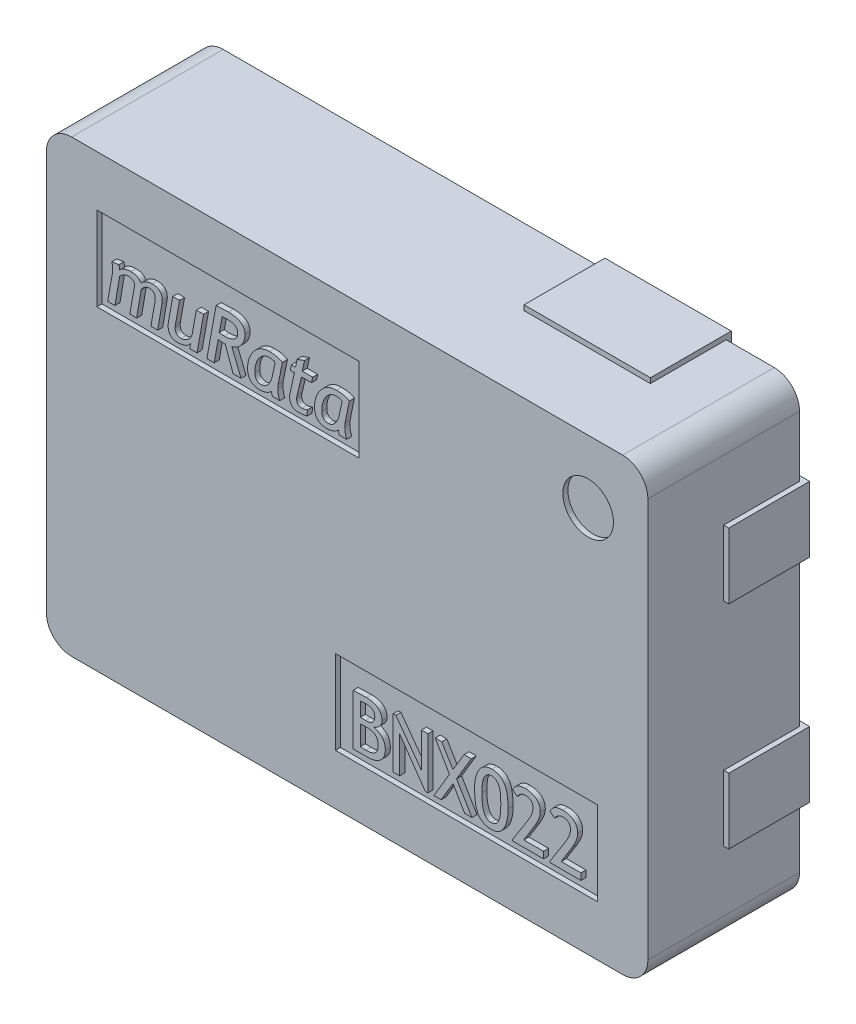
from build123d import *

# Parameters (mm, degrees)
SKETCH_1_W          = 1
SKETCH_1_H          = 1.3
EXTRUDE_1_DEPTH     = 1.6
EXTRUDE_1_2_DEPTH   = 1.6
EXTRUDE_1_3_DEPTH   = 1.6
EXTRUDE_1_4_DEPTH   = 1.6
SKETCH_1_W_2        = 7
SKETCH_1_H_2        = 0.3
EXTRUDE_1_5_DEPTH   = 1.6
SKETCH_1_W_3        = 2.5
EXTRUDE_1_6_DEPTH   = 1.6
SKETCH_2_W          = 11.9
SKETCH_2_H          = 8.9
EXTRUDE_2_DEPTH     = 3
SKETCH_3_R          = 0.5
SKETCH_3_W          = 5.181994718
SKETCH_3_H          = 1.659340636
CUT_EXTRUDE_1_DEPTH = 0.1
EXTRUDE_3_DEPTH     = 0.1
FILLET_1_R          = 0.5


with BuildPart() as part:
    # Эскиз1 → Бобышка-Вытянуть1 (new body)
    with BuildSketch(Plane.XY):
        with Locations((-5.55, -2.1)):
            Rectangle(SKETCH_1_W, SKETCH_1_H)
    extrude(amount=EXTRUDE_1_DEPTH)



with BuildPart() as body_2:
    # Эскиз1 → Extrude 1 2 (new body)
    with BuildSketch(Plane.XY):
        with Locations((-5.55, 2.1)):
            Rectangle(SKETCH_1_W, SKETCH_1_H)
    extrude(amount=EXTRUDE_1_2_DEPTH)


with BuildPart() as body_3:
    # Эскиз1 → Extrude 1 3 (new body)
    with BuildSketch(Plane.XY):
        with Locations((5.55, -2.1)):
            Rectangle(SKETCH_1_W, SKETCH_1_H)
    extrude(amount=EXTRUDE_1_3_DEPTH)


with BuildPart() as body_4:
    # Эскиз1 → Extrude 1 4 (new body)
    with BuildSketch(Plane.XY):
        with Locations((5.55, 2.1)):
            Rectangle(SKETCH_1_W, SKETCH_1_H)
    extrude(amount=EXTRUDE_1_4_DEPTH)


with BuildPart() as body_5:
    # Эскиз1 → Extrude 1 5 (new body)
    with BuildSketch(Plane.XY):
        with Locations((1, -4.4)):
            Rectangle(SKETCH_1_W_2, SKETCH_1_H_2)
    extrude(amount=EXTRUDE_1_5_DEPTH)


with BuildPart() as body_6:
    # Эскиз1 → Extrude 1 6 (new body)
    with BuildSketch(Plane.XY):
        with Locations((3.25, 4.4)):
            Rectangle(SKETCH_1_W_3, SKETCH_1_H_2)
    extrude(amount=EXTRUDE_1_6_DEPTH)


with BuildPart() as part_1:
    add(part.part)

    add(body_2.part)  # Бобышка-Вытянуть2 merges body 2

    add(body_3.part)  # Бобышка-Вытянуть2 merges body 3

    add(body_4.part)  # Бобышка-Вытянуть2 merges body 4

    add(body_5.part)  # Бобышка-Вытянуть2 merges body 5

    add(body_6.part)  # Бобышка-Вытянуть2 merges body 6
    # Эскиз2 → Бобышка-Вытянуть2 (add)
    with BuildSketch(Plane.XY.offset(0.1)):
        Rectangle(SKETCH_2_W, SKETCH_2_H)
    extrude(amount=EXTRUDE_2_DEPTH)

    # Эскиз3 → Вырез-Вытянуть1 (cut)
    with BuildSketch(Plane.XY.offset(3.1)):
        with Locations((4.768230873, 3.203976716)):
            Circle(SKETCH_3_R)
        with Locations((-2.359002641, 2.620329682)):
            Rectangle(SKETCH_3_W, SKETCH_3_H)
        with Locations((2.359002641, -2.620329682)):
            Rectangle(SKETCH_3_W, SKETCH_3_H)
    extrude(amount=-CUT_EXTRUDE_1_DEPTH, mode=Mode.SUBTRACT)

    # Эскиз4 → Бобышка-Вытянуть3 (add)
    # profile 1 of 12: a face of its own
    with BuildSketch(Plane.XY.offset(3)):
        with BuildLine():
            Line((-3.881526992, 1.990659364), (-3.801981537, 2.454336312))
            add(Edge.make_bspline(
                [(-3.801981537, 2.454336312), (-3.800646377, 2.463316333), (-3.798045168, 2.480811548), (-3.797553589, 2.498491126), (-3.797314329, 2.507096052)],
                knots=[0, 0, 0, 0, 1.02656884, 2, 2, 2, 2], degree=3))
            add(Edge.make_bspline(
                [(-3.797314329, 2.507096052), (-3.797596482, 2.516531636), (-3.798128241, 2.534314377), (-3.803836438, 2.559106752), (-3.813195308, 2.580216933), (-3.826515071, 2.597667715), (-3.843856784, 2.611160489), (-3.865034541, 2.62049005), (-3.88975161, 2.626197259), (-3.907467207, 2.626737378), (-3.916835433, 2.627023)],
                knots=[0, 0, 0, 0, 1.165338575, 2.196251465, 3.124750257, 4.001607519, 4.883598347, 5.812097139, 6.843010029, 8, 8, 8, 8], degree=3))
            add(Edge.make_bspline(
                [(-3.916835433, 2.627023), (-3.92417594, 2.626673684), (-3.93913903, 2.62596163), (-3.961525805, 2.619878562), (-3.983929085, 2.610214975), (-4.005947727, 2.597084937), (-4.026611718, 2.581388067), (-4.045141497, 2.563769163), (-4.061021095, 2.544497129), (-4.06921666, 2.53022001), (-4.073288355, 2.523126896)],
                knots=[0, 0, 0, 0, 0.897125573, 1.828725236, 2.818944493, 3.876622128, 4.957752456, 5.988225249, 7.000516339, 8, 8, 8, 8], degree=3))
            Line((-4.073288355, 2.523126896), (-4.164197446, 1.990659364))
            Line((-4.164197446, 1.990659364), (-4.298734784, 1.990659364))
            Line((-4.298734784, 1.990659364), (-4.208637381, 2.510342805))
            add(Edge.make_bspline(
                [(-4.208637381, 2.510342805), (-4.207993245, 2.514053475), (-4.206780744, 2.521038313), (-4.206663241, 2.528124858), (-4.20660816, 2.531446701)],
                knots=[0, 0, 0, 0, 1.062492834, 2, 2, 2, 2], degree=3))
            add(Edge.make_bspline(
                [(-4.20660816, 2.531446701), (-4.206935277, 2.53893856), (-4.207561159, 2.553272992), (-4.21404408, 2.573279926), (-4.224635661, 2.59032131), (-4.239699736, 2.604095808), (-4.258831583, 2.614652572), (-4.281984582, 2.621998915), (-4.309119839, 2.626404006), (-4.328545819, 2.626807603), (-4.338913355, 2.627023)],
                knots=[0, 0, 0, 0, 0.966132594, 1.848535045, 2.685778888, 3.533692158, 4.458059346, 5.489792084, 6.660316188, 8, 8, 8, 8], degree=3))
            add(Edge.make_bspline(
                [(-4.338913355, 2.627023), (-4.345775226, 2.626631649), (-4.360022871, 2.625819067), (-4.381861842, 2.620106898), (-4.404745653, 2.61107934), (-4.428066055, 2.598921255), (-4.45035987, 2.584639993), (-4.470610127, 2.569499953), (-4.487902564, 2.553534703), (-4.497322323, 2.541777371), (-4.501859784, 2.536113909)],
                knots=[0, 0, 0, 0, 0.858131112, 1.781780593, 2.80801687, 3.932170532, 5.066093008, 6.117186899, 7.093056259, 8, 8, 8, 8], degree=3))
            Line((-4.501859784, 2.536113909), (-4.592768875, 1.990659364))
            Line((-4.592768875, 1.990659364), (-4.737452316, 1.990659364))
            Line((-4.737452316, 1.990659364), (-4.641673095, 2.524344429))
            add(Edge.make_bspline(
                [(-4.641673095, 2.524344429), (-4.641006323, 2.528599074), (-4.639561684, 2.537817247), (-4.638551057, 2.552809944), (-4.637636748, 2.569990497), (-4.637622336, 2.582175389), (-4.637614654, 2.588670727)],
                knots=[0, 0, 0, 0, 0.800541423, 1.734464059, 2.792322178, 4, 4, 4, 4], degree=3))
            add(Edge.make_bspline(
                [(-4.637614654, 2.588670727), (-4.63780645, 2.600251216), (-4.638173289, 2.622400704), (-4.642056821, 2.653853401), (-4.648183557, 2.682057251), (-4.655042864, 2.698930701), (-4.658312706, 2.706974299)],
                knots=[0, 0, 0, 0, 1.148139457, 2.195995544, 3.140028527, 4, 4, 4, 4], degree=3))
            Line((-4.658312706, 2.706974299), (-4.516267251, 2.730919104))
            add(Edge.make_bspline(
                [(-4.516267251, 2.730919104), (-4.514367389, 2.722817467), (-4.51066186, 2.707015872), (-4.506481421, 2.683713319), (-4.50322666, 2.661528383), (-4.50230723, 2.647054042), (-4.501859784, 2.640010013)],
                knots=[0, 0, 0, 0, 1.08313698, 2.112572101, 3.081471322, 4, 4, 4, 4], degree=3))
            add(Edge.make_bspline(
                [(-4.501859784, 2.640010013), (-4.496752928, 2.646853142), (-4.486268566, 2.660902068), (-4.465222185, 2.678607834), (-4.440154438, 2.694239438), (-4.4110326, 2.706999748), (-4.379664394, 2.71762189), (-4.346991924, 2.72535121), (-4.313608602, 2.729900486), (-4.29117274, 2.730577718), (-4.279863031, 2.730919104)],
                knots=[0, 0, 0, 0, 0.822505251, 1.688601343, 2.636803891, 3.669145775, 4.751892822, 5.832804686, 6.907536918, 8, 8, 8, 8], degree=3))
            add(Edge.make_bspline(
                [(-4.279863031, 2.730919104), (-4.267400282, 2.730635822), (-4.243520809, 2.730093033), (-4.209403781, 2.72522229), (-4.178639817, 2.717160339), (-4.151214649, 2.705970432), (-4.127388141, 2.691069161), (-4.107035758, 2.673021394), (-4.089960174, 2.651647343), (-4.081862319, 2.635312809), (-4.077752641, 2.627023)],
                knots=[0, 0, 0, 0, 1.237715316, 2.371546605, 3.414827764, 4.39083205, 5.30264959, 6.192812572, 7.082848704, 8, 8, 8, 8], degree=3))
            add(Edge.make_bspline(
                [(-4.077752641, 2.627023), (-4.072216638, 2.634379287), (-4.060856313, 2.64947498), (-4.039038253, 2.669250895), (-4.013047192, 2.686821497), (-3.983580627, 2.702146321), (-3.952109685, 2.714596144), (-3.920116822, 2.724159525), (-3.888153704, 2.729806888), (-3.866869804, 2.730551556), (-3.856364654, 2.730919104)],
                knots=[0, 0, 0, 0, 0.871689691, 1.788777654, 2.776398268, 3.841032672, 4.932299696, 5.981885438, 7.003913911, 8, 8, 8, 8], degree=3))
            add(Edge.make_bspline(
                [(-3.856364654, 2.730919104), (-3.848312311, 2.730735849), (-3.832790151, 2.730382596), (-3.810180508, 2.728446064), (-3.789249923, 2.72474404), (-3.769688641, 2.719995395), (-3.751783852, 2.713415225), (-3.735300325, 2.705631131), (-3.720501697, 2.69613864), (-3.707230726, 2.685314059), (-3.695344491, 2.67317994), (-3.685366379, 2.65933327), (-3.67681314, 2.644220738), (-3.669623583, 2.627657391), (-3.664251639, 2.609589091), (-3.660366428, 2.590096815), (-3.658202838, 2.56923923), (-3.657873075, 2.554855167), (-3.65770394, 2.547477546)],
                knots=[0, 0, 0, 0, 1.246591708, 2.403002083, 3.508033586, 4.533898789, 5.514251456, 6.455472193, 7.349999276, 8.228077579, 9.101775788, 9.970819607, 10.861662966, 11.785487015, 12.759220529, 13.77353434, 14.858040255, 16, 16, 16, 16], degree=3))
            add(Edge.make_bspline(
                [(-3.65770394, 2.547477546), (-3.65793856, 2.536701113), (-3.658423152, 2.51444317), (-3.661964723, 2.492461186), (-3.663791602, 2.481122026)],
                knots=[0, 0, 0, 0, 0.968322441, 2, 2, 2, 2], degree=3))
            Line((-3.663791602, 2.481122026), (-3.748613031, 1.990659364))
            Line((-3.748613031, 1.990659364), (-3.881526992, 1.990659364))
        make_face()
    # profile 2 of 12: a face of its own
    with BuildSketch(Plane.XY.offset(3)):
        with BuildLine():
            Line((-3.31598316, 2.717932091), (-3.397557836, 2.256487286))
            add(Edge.make_bspline(
                [(-3.397557836, 2.256487286), (-3.399043145, 2.246968832), (-3.401877164, 2.228807312), (-3.402525342, 2.210439545), (-3.40283381, 2.201698325)],
                knots=[0, 0, 0, 0, 1.0482001, 2, 2, 2, 2], degree=3))
            add(Edge.make_bspline(
                [(-3.40283381, 2.201698325), (-3.402562252, 2.192258041), (-3.402050461, 2.174466442), (-3.396202175, 2.149699382), (-3.387256464, 2.128367408), (-3.373817319, 2.110928009), (-3.356539927, 2.097486276), (-3.335531491, 2.088090496), (-3.311006253, 2.082395856), (-3.293424741, 2.081854712), (-3.284124394, 2.081568455)],
                knots=[0, 0, 0, 0, 1.168243006, 2.201725291, 3.136760649, 4.015803345, 4.899992402, 5.823179172, 6.84849556, 8, 8, 8, 8], degree=3))
            add(Edge.make_bspline(
                [(-3.284124394, 2.081568455), (-3.278026554, 2.081705185), (-3.265907617, 2.081976924), (-3.247830612, 2.08477561), (-3.229948395, 2.089208039), (-3.212263666, 2.095589658), (-3.194774039, 2.103555021), (-3.177358235, 2.113084643), (-3.160405913, 2.124778681), (-3.143726055, 2.13784429), (-3.127807978, 2.151969853), (-3.113610449, 2.167293665), (-3.100945135, 2.18313878), (-3.089964267, 2.199642393), (-3.080468282, 2.21673736), (-3.073055632, 2.234690868), (-3.0670021, 2.253263503), (-3.064436781, 2.266060446), (-3.063142251, 2.27251813)],
                knots=[0, 0, 0, 0, 0.929686712, 1.847672986, 2.783752511, 3.736856134, 4.711340751, 5.713677239, 6.761263039, 7.849192658, 8.945314047, 10.004023173, 11.032267895, 12.036886102, 13.025206201, 14.010342428, 14.995964995, 16, 16, 16, 16], degree=3))
            Line((-3.063142251, 2.27251813), (-2.983393875, 2.717932091))
            Line((-2.983393875, 2.717932091), (-2.839522121, 2.717932091))
            Line((-2.839522121, 2.717932091), (-2.969392251, 1.990659364))
            Line((-2.969392251, 1.990659364), (-3.114278615, 1.990659364))
            Line((-3.114278615, 1.990659364), (-3.093783485, 2.094555468))
            add(Edge.make_bspline(
                [(-3.093783485, 2.094555468), (-3.100465242, 2.085184532), (-3.113770103, 2.066524919), (-3.138814966, 2.042809302), (-3.16690558, 2.022372522), (-3.19874986, 2.00590362), (-3.234051221, 1.993204406), (-3.272787435, 1.984127303), (-3.314945695, 1.97862684), (-3.3442396, 1.977997984), (-3.359408485, 1.977672351)],
                knots=[0, 0, 0, 0, 0.909652853, 1.811320582, 2.716799533, 3.653680856, 4.63998368, 5.680763126, 6.799059422, 8, 8, 8, 8], degree=3))
            add(Edge.make_bspline(
                [(-3.359408485, 1.977672351), (-3.366384567, 1.977809832), (-3.379908294, 1.978076351), (-3.399573343, 1.980665282), (-3.418092957, 1.98437697), (-3.435487503, 1.989936221), (-3.451749869, 1.996941931), (-3.466744959, 2.005831575), (-3.48053038, 2.016199472), (-3.493262795, 2.027980876), (-3.504356793, 2.041453364), (-3.514139978, 2.056141017), (-3.522581763, 2.072065489), (-3.529200708, 2.089479417), (-3.534515254, 2.108139196), (-3.538054735, 2.128133425), (-3.540353789, 2.149358625), (-3.540662052, 2.163948429), (-3.540820823, 2.171462935)],
                knots=[0, 0, 0, 0, 1.10943704, 2.150737634, 3.15130267, 4.111213706, 5.051062776, 5.962947454, 6.877812674, 7.791600948, 8.716290168, 9.647657733, 10.59609568, 11.577489236, 12.606479557, 13.678909857, 14.804518185, 16, 16, 16, 16], degree=3))
            add(Edge.make_bspline(
                [(-3.540820823, 2.171462935), (-3.540522787, 2.182781588), (-3.539900802, 2.206402984), (-3.536102609, 2.22972834), (-3.534124394, 2.241876896)],
                knots=[0, 0, 0, 0, 0.958339047, 2, 2, 2, 2], degree=3))
            Line((-3.534124394, 2.241876896), (-3.449911732, 2.717932091))
            Line((-3.449911732, 2.717932091), (-3.31598316, 2.717932091))
        make_face()
    # profile 3 of 12: a face of its own
    with BuildSketch(Plane.XY.offset(3)):
        with BuildLine():
            Line((-2.255106537, 1.990659364), (-2.410950693, 2.419230792))
            add(Edge.make_bspline(
                [(-2.410950693, 2.419230792), (-2.420289212, 2.419412222), (-2.440548305, 2.419805816), (-2.473300146, 2.422484303), (-2.510788985, 2.426518462), (-2.537313438, 2.430243397), (-2.551372771, 2.432217805)],
                knots=[0, 0, 0, 0, 0.794054174, 1.722630377, 2.792876285, 4, 4, 4, 4], degree=3))
            Line((-2.551372771, 2.432217805), (-2.629903615, 1.990659364))
            Line((-2.629903615, 1.990659364), (-2.774587057, 1.990659364))
            Line((-2.774587057, 1.990659364), (-2.592768875, 2.990659364))
            add(Edge.make_bspline(
                [(-2.592768875, 2.990659364), (-2.590197383, 2.990702145), (-2.584439991, 2.99079793), (-2.574984845, 2.991571501), (-2.563745845, 2.992057214), (-2.550904591, 2.992979601), (-2.536343533, 2.99363957), (-2.520197968, 2.995029477), (-2.502260832, 2.99613686), (-2.476771986, 2.998064296), (-2.44539024, 3.000149844), (-2.410024732, 3.002342782), (-2.378285717, 3.003309275), (-2.358394248, 3.003538707), (-2.349059459, 3.003646377)],
                knots=[0, 0, 0, 0, 0.379205994, 0.84901576, 1.398492177, 2.038179615, 2.747573999, 3.547867495, 4.427762936, 5.397917485, 7.317627882, 9.066214761, 10.623215523, 12, 12, 12, 12], degree=3))
            add(Edge.make_bspline(
                [(-2.349059459, 3.003646377), (-2.336336882, 3.003535537), (-2.311533993, 3.003319454), (-2.27550345, 3.000351666), (-2.241701159, 2.995931623), (-2.210104698, 2.990014354), (-2.180900609, 2.981852174), (-2.153857204, 2.972111467), (-2.129048802, 2.960641343), (-2.106626331, 2.947201682), (-2.086590441, 2.932138019), (-2.069048058, 2.91554135), (-2.05423254, 2.89726097), (-2.042143321, 2.877401747), (-2.032812594, 2.855947375), (-2.026016755, 2.833000386), (-2.022225738, 2.808493258), (-2.021639922, 2.791672933), (-2.021340303, 2.783070078)],
                knots=[0, 0, 0, 0, 1.371015623, 2.672819113, 3.893705581, 5.04478121, 6.134436109, 7.158501773, 8.140297429, 9.075592003, 9.970929856, 10.837300292, 11.671951042, 12.499726858, 13.335523232, 14.186821977, 15.072639292, 16, 16, 16, 16], degree=3))
            add(Edge.make_bspline(
                [(-2.021340303, 2.783070078), (-2.021583322, 2.772778794), (-2.022064335, 2.75240901), (-2.025618006, 2.722353767), (-2.031221001, 2.693208521), (-2.039350679, 2.665076596), (-2.050026788, 2.638080814), (-2.062623278, 2.611875974), (-2.077671036, 2.586659595), (-2.095078727, 2.562761283), (-2.113976298, 2.540279998), (-2.134401801, 2.519995372), (-2.155715992, 2.501492399), (-2.178500663, 2.485521659), (-2.202407114, 2.471623992), (-2.22742584, 2.459800514), (-2.25372663, 2.450179807), (-2.271903949, 2.445525348), (-2.281080563, 2.443175598)],
                knots=[0, 0, 0, 0, 1.068642213, 2.115189014, 3.138850416, 4.148213864, 5.151422374, 6.150564156, 7.164999814, 8.196441807, 9.218269553, 10.211764462, 11.183283622, 12.146128331, 13.096799659, 14.052131676, 15.016640767, 16, 16, 16, 16], degree=3))
            Line((-2.281080563, 2.443175598), (-2.099262381, 1.990659364))
            Line((-2.099262381, 1.990659364), (-2.255106537, 1.990659364))
        make_face()
        with BuildLine():
            Line((-2.471624394, 2.861195078), (-2.530471797, 2.562087935))
            add(Edge.make_bspline(
                [(-2.530471797, 2.562087935), (-2.522173938, 2.560087548), (-2.505873667, 2.556157997), (-2.481595086, 2.552202212), (-2.458086172, 2.549582033), (-2.442680875, 2.549259615), (-2.43509842, 2.549100922)],
                knots=[0, 0, 0, 0, 1.06117625, 2.084569028, 3.057228794, 4, 4, 4, 4], degree=3))
            add(Edge.make_bspline(
                [(-2.43509842, 2.549100922), (-2.425150312, 2.549260459), (-2.405769572, 2.549571265), (-2.377458674, 2.551878634), (-2.35058474, 2.555381776), (-2.325291112, 2.560788349), (-2.301284161, 2.567060748), (-2.279032759, 2.575593184), (-2.257964077, 2.584940955), (-2.238758382, 2.596179719), (-2.221222804, 2.608432895), (-2.20595795, 2.622045831), (-2.192936929, 2.636745567), (-2.182555725, 2.652743076), (-2.174359876, 2.669718139), (-2.168378666, 2.687770055), (-2.164910609, 2.707044405), (-2.164438907, 2.720285542), (-2.164197446, 2.727063585)],
                knots=[0, 0, 0, 0, 1.318555309, 2.568787749, 3.76331209, 4.908106282, 5.99571057, 7.048304013, 8.0634545, 9.047723523, 9.993120255, 10.894861156, 11.752692725, 12.588305759, 13.414436077, 14.245224514, 15.10174298, 16, 16, 16, 16], degree=3))
            add(Edge.make_bspline(
                [(-2.164197446, 2.727063585), (-2.16433764, 2.733227798), (-2.164606909, 2.745067294), (-2.167097497, 2.76214708), (-2.171140069, 2.777878505), (-2.176725194, 2.792341396), (-2.184199466, 2.805338151), (-2.193147502, 2.817005075), (-2.203820866, 2.827268217), (-2.216284658, 2.836035086), (-2.230432994, 2.843912193), (-2.246900852, 2.850210344), (-2.265355994, 2.856011795), (-2.286130062, 2.860210109), (-2.308911756, 2.864033739), (-2.333945041, 2.866209457), (-2.361073388, 2.868009423), (-2.379899914, 2.868065438), (-2.389643875, 2.868094429)],
                knots=[0, 0, 0, 0, 0.970882309, 1.864756403, 2.712712936, 3.526206286, 4.299608178, 5.067111781, 5.836020324, 6.622820496, 7.462429206, 8.380814719, 9.395636889, 10.507829739, 11.716927922, 13.034177955, 14.464992795, 16, 16, 16, 16], degree=3))
            add(Edge.make_bspline(
                [(-2.389643875, 2.868094429), (-2.394582994, 2.867994548), (-2.40575764, 2.867768569), (-2.424374546, 2.866484038), (-2.446753123, 2.864153489), (-2.462901399, 2.862232669), (-2.471624394, 2.861195078)],
                knots=[0, 0, 0, 0, 0.720119101, 1.629253315, 2.7193673, 4, 4, 4, 4], degree=3))
        make_face(mode=Mode.SUBTRACT)
    # profile 4 of 12: a face of its own
    with BuildSketch(Plane.XY.offset(3)):
        with BuildLine():
            Line((-1.281080563, 2.671462935), (-1.36671368, 2.248979169))
            add(Edge.make_bspline(
                [(-1.36671368, 2.248979169), (-1.367509247, 2.244454734), (-1.369165297, 2.235036693), (-1.370711023, 2.22012469), (-1.37173967, 2.2038772), (-1.371904075, 2.192568627), (-1.371989654, 2.186682091)],
                knots=[0, 0, 0, 0, 0.880312417, 1.832454093, 2.871711028, 4, 4, 4, 4], degree=3))
            add(Edge.make_bspline(
                [(-1.371989654, 2.186682091), (-1.371544454, 2.169336932), (-1.370667361, 2.135165104), (-1.363031904, 2.08495066), (-1.351200068, 2.03652405), (-1.339065534, 2.005896525), (-1.333028615, 1.990659364)],
                knots=[0, 0, 0, 0, 1.033994332, 2.037079905, 3.023449283, 4, 4, 4, 4], degree=3))
            Line((-1.333028615, 1.990659364), (-1.475885758, 1.990659364))
            add(Edge.make_bspline(
                [(-1.475885758, 1.990659364), (-1.477842783, 1.995166551), (-1.482245784, 2.005307016), (-1.488008138, 2.022896996), (-1.493732935, 2.044434108), (-1.497561725, 2.060118533), (-1.499627641, 2.068581442)],
                knots=[0, 0, 0, 0, 0.722441994, 1.625381448, 2.718717403, 4, 4, 4, 4], degree=3))
            add(Edge.make_bspline(
                [(-1.499627641, 2.068581442), (-1.505579324, 2.061937316), (-1.517856151, 2.048232154), (-1.54101509, 2.031233277), (-1.567521944, 2.015379057), (-1.59782199, 2.002235352), (-1.630411279, 1.991346861), (-1.664431847, 1.983393435), (-1.699506197, 1.978637479), (-1.723233209, 1.977996284), (-1.735220173, 1.977672351)],
                knots=[0, 0, 0, 0, 0.821805603, 1.69517847, 2.639052837, 3.671035773, 4.737790333, 5.809107984, 6.893154106, 8, 8, 8, 8], degree=3))
            add(Edge.make_bspline(
                [(-1.735220173, 1.977672351), (-1.744158684, 1.977852779), (-1.761616311, 1.978205171), (-1.786989482, 1.98136206), (-1.810928683, 1.986132921), (-1.833367851, 1.993062612), (-1.854364814, 2.001951198), (-1.873721885, 2.012986978), (-1.891572933, 2.025887136), (-1.907821635, 2.040687058), (-1.922318972, 2.057450095), (-1.934952698, 2.076053519), (-1.945716743, 2.096392564), (-1.954462714, 2.118444632), (-1.961112478, 2.142197436), (-1.96597519, 2.167576635), (-1.968798001, 2.19473537), (-1.969190209, 2.213393534), (-1.969392251, 2.223005143)],
                knots=[0, 0, 0, 0, 1.111634051, 2.171110246, 3.176217618, 4.145126234, 5.087692522, 6.007288195, 6.911232843, 7.822628727, 8.735422221, 9.662075877, 10.614508326, 11.592764186, 12.607687977, 13.678831044, 14.804267664, 16, 16, 16, 16], degree=3))
            add(Edge.make_bspline(
                [(-1.969392251, 2.223005143), (-1.969060716, 2.239390468), (-1.968403824, 2.271855825), (-1.962579041, 2.319787577), (-1.953026279, 2.366267548), (-1.939740222, 2.411317392), (-1.922977488, 2.455054091), (-1.902060447, 2.49728983), (-1.877481812, 2.538071668), (-1.849509063, 2.576995688), (-1.818614448, 2.612931437), (-1.785134155, 2.64459225), (-1.749267244, 2.671220436), (-1.711333543, 2.693176857), (-1.671050863, 2.710014678), (-1.628752508, 2.722358448), (-1.584218612, 2.729505784), (-1.553833057, 2.730442765), (-1.538385758, 2.730919104)],
                knots=[0, 0, 0, 0, 1.061729473, 2.103676697, 3.124310562, 4.134276098, 5.144698305, 6.156441792, 7.185039331, 8.227816387, 9.259753568, 10.252287385, 11.208070691, 12.148854027, 13.086085739, 14.03098729, 14.999000388, 16, 16, 16, 16], degree=3))
            add(Edge.make_bspline(
                [(-1.538385758, 2.730919104), (-1.523974932, 2.730697743), (-1.496142982, 2.730270224), (-1.455957371, 2.727761745), (-1.418953308, 2.723130013), (-1.385120816, 2.716666673), (-1.354338735, 2.708554319), (-1.326912276, 2.698092604), (-1.302272567, 2.686370557), (-1.287996514, 2.676327996), (-1.281080563, 2.671462935)],
                knots=[0, 0, 0, 0, 1.288922014, 2.489323897, 3.599110064, 4.62183425, 5.568400164, 6.441432534, 7.244961105, 8, 8, 8, 8], degree=3))
        make_face()
        with BuildLine():
            add(Edge.make_bspline(
                [(-1.423937706, 2.597599299), (-1.425853773, 2.600018912), (-1.429961512, 2.605206171), (-1.439311996, 2.611037999), (-1.45112395, 2.615941477), (-1.465623206, 2.620164082), (-1.482883869, 2.623351958), (-1.502902406, 2.625398737), (-1.525714606, 2.626893168), (-1.541832487, 2.626978084), (-1.55035816, 2.627023)],
                knots=[0, 0, 0, 0, 0.551484403, 1.182293313, 1.950456866, 2.850972371, 3.890987772, 5.102481836, 6.4673361, 8, 8, 8, 8], degree=3))
            add(Edge.make_bspline(
                [(-1.55035816, 2.627023), (-1.559379796, 2.626660614), (-1.577307332, 2.625940491), (-1.60375145, 2.620481225), (-1.629357953, 2.611488039), (-1.654020223, 2.598689348), (-1.677942844, 2.582588187), (-1.700756966, 2.562562379), (-1.722838941, 2.539145817), (-1.743936894, 2.512577013), (-1.763397261, 2.483342321), (-1.780104484, 2.4517654), (-1.794679833, 2.418679252), (-1.806184387, 2.38363832), (-1.815347516, 2.346954152), (-1.821700141, 2.308404264), (-1.825988069, 2.268150822), (-1.826350359, 2.240671008), (-1.826535108, 2.22665774)],
                knots=[0, 0, 0, 0, 0.807325667, 1.604294567, 2.406858554, 3.230265969, 4.085251362, 4.982580944, 5.94218883, 6.963689248, 8.016870502, 9.081706311, 10.158462295, 11.250103454, 12.37965822, 13.540583242, 14.745826115, 16, 16, 16, 16], degree=3))
            add(Edge.make_bspline(
                [(-1.826535108, 2.22665774), (-1.826386087, 2.22077126), (-1.826097887, 2.209387103), (-1.824801145, 2.192884143), (-1.822118018, 2.177556878), (-1.818458211, 2.163399548), (-1.814074374, 2.150198505), (-1.808353081, 2.138254403), (-1.801695354, 2.127307123), (-1.79362324, 2.117828242), (-1.784940085, 2.109140793), (-1.775024006, 2.101844657), (-1.764217993, 2.095406209), (-1.752189702, 2.090502158), (-1.739272158, 2.086296493), (-1.725305674, 2.083565242), (-1.710299857, 2.081932659), (-1.69998385, 2.081692803), (-1.694635758, 2.081568455)],
                knots=[0, 0, 0, 0, 1.257263473, 2.431484161, 3.530839888, 4.5747199, 5.55214106, 6.495351318, 7.397067608, 8.279138343, 9.147264773, 10.013827986, 10.900615711, 11.826077453, 12.780718316, 13.797571979, 14.858202714, 16, 16, 16, 16], degree=3))
            add(Edge.make_bspline(
                [(-1.694635758, 2.081568455), (-1.688933061, 2.081724215), (-1.677488741, 2.082036799), (-1.660658582, 2.085821564), (-1.64388145, 2.091012516), (-1.62759024, 2.098807457), (-1.611460202, 2.108726581), (-1.595845882, 2.120939929), (-1.58017425, 2.135053294), (-1.565235168, 2.15144718), (-1.550680549, 2.169316544), (-1.537258497, 2.18865733), (-1.525126512, 2.209272235), (-1.513838668, 2.230917726), (-1.504234322, 2.254113692), (-1.495211519, 2.278260279), (-1.487749329, 2.303801253), (-1.483651291, 2.32126717), (-1.481567576, 2.330148)],
                knots=[0, 0, 0, 0, 0.778171494, 1.561654801, 2.348351463, 3.175738455, 4.0226874, 4.932716775, 5.881979682, 6.902821865, 7.96145756, 9.031182955, 10.1175668, 11.230123888, 12.365468936, 13.547423776, 14.752947684, 16, 16, 16, 16], degree=3))
            Line((-1.481567576, 2.330148), (-1.423937706, 2.597599299))
        make_face(mode=Mode.SUBTRACT)
    # profile 5 of 12: a face of its own
    with BuildSketch(Plane.XY.offset(3)):
        with BuildLine():
            Line((-1.04345881, 2.614035987), (-1.125236407, 2.614035987))
            Line((-1.125236407, 2.614035987), (-1.103929589, 2.717932091))
            Line((-1.103929589, 2.717932091), (-1.021340303, 2.717932091))
            Line((-1.021340303, 2.717932091), (-0.990901992, 2.869717805))
            Line((-0.990901992, 2.869717805), (-0.841145498, 2.925724299))
            Line((-0.841145498, 2.925724299), (-0.889643875, 2.717932091))
            Line((-0.889643875, 2.717932091), (-0.681851667, 2.717932091))
            Line((-0.681851667, 2.717932091), (-0.703767251, 2.614035987))
            Line((-0.703767251, 2.614035987), (-0.902225044, 2.614035987))
            Line((-0.902225044, 2.614035987), (-0.989278615, 2.256690208))
            add(Edge.make_bspline(
                [(-0.989278615, 2.256690208), (-0.99084905, 2.250145243), (-0.993782291, 2.237920629), (-0.9966864, 2.220544927), (-0.999031553, 2.205615867), (-0.999301969, 2.196361713), (-0.999424719, 2.192160987)],
                knots=[0, 0, 0, 0, 1.233572037, 2.304052259, 3.23016081, 4, 4, 4, 4], degree=3))
            add(Edge.make_bspline(
                [(-0.999424719, 2.192160987), (-0.999162184, 2.183476044), (-0.998669175, 2.167166774), (-0.993769596, 2.144345364), (-0.985722078, 2.124847038), (-0.974185255, 2.108667275), (-0.958949956, 2.096390212), (-0.940670107, 2.087517228), (-0.919049965, 2.082571065), (-0.903670706, 2.081915516), (-0.895528615, 2.081568455)],
                knots=[0, 0, 0, 0, 1.197848575, 2.249414458, 3.203555126, 4.092816188, 4.962236246, 5.877028744, 6.876056063, 8, 8, 8, 8], degree=3))
            add(Edge.make_bspline(
                [(-0.895528615, 2.081568455), (-0.886918687, 2.081909868), (-0.869309644, 2.082608127), (-0.842506769, 2.087554457), (-0.81479598, 2.095492909), (-0.796441042, 2.102904538), (-0.786965303, 2.106730792)],
                knots=[0, 0, 0, 0, 0.920906584, 1.883440045, 2.907325597, 4, 4, 4, 4], degree=3))
            Line((-0.786965303, 2.106730792), (-0.791632511, 1.99715287))
            add(Edge.make_bspline(
                [(-0.791632511, 1.99715287), (-0.796691106, 1.995614572), (-0.807401213, 1.992357672), (-0.824718999, 1.988257465), (-0.844215794, 1.985237959), (-0.865770578, 1.982226087), (-0.88956179, 1.980433274), (-0.915526104, 1.978648115), (-0.94368629, 1.978012878), (-0.963169494, 1.977788445), (-0.973247771, 1.977672351)],
                knots=[0, 0, 0, 0, 0.692085414, 1.465290244, 2.327068394, 3.273819328, 4.313598275, 5.449213438, 6.680528474, 8, 8, 8, 8], degree=3))
            add(Edge.make_bspline(
                [(-0.973247771, 1.977672351), (-0.979545441, 1.977834273), (-0.991843026, 1.97815046), (-1.009767516, 1.980437833), (-1.026717438, 1.984022042), (-1.04262217, 1.989245008), (-1.057265113, 1.996302269), (-1.071060345, 2.004392104), (-1.083710456, 2.014173357), (-1.09502565, 2.025606413), (-1.105213211, 2.038259273), (-1.114195445, 2.051994707), (-1.12144903, 2.067004525), (-1.127590542, 2.082945438), (-1.13248548, 2.100044907), (-1.135860181, 2.118322491), (-1.137948035, 2.1377289), (-1.138129923, 2.151029906), (-1.13822342, 2.157867156)],
                knots=[0, 0, 0, 0, 1.09086965, 2.1301625, 3.125445398, 4.088968038, 5.022078813, 5.936532179, 6.85540521, 7.783498431, 8.716903517, 9.66606585, 10.619918997, 11.599275229, 12.623057858, 13.696413573, 14.815864376, 16, 16, 16, 16], degree=3))
            add(Edge.make_bspline(
                [(-1.13822342, 2.157867156), (-1.137848091, 2.164923357), (-1.137015422, 2.180577541), (-1.133734736, 2.19591325), (-1.131932836, 2.204336312)],
                knots=[0, 0, 0, 0, 0.901509963, 2, 2, 2, 2], degree=3))
            Line((-1.131932836, 2.204336312), (-1.04345881, 2.614035987))
        make_face()
    # profile 6 of 12: a face of its own
    with BuildSketch(Plane.XY.offset(3)):
        with BuildLine():
            Line((0.043594762, 2.671462935), (-0.042038355, 2.248979169))
            add(Edge.make_bspline(
                [(-0.042038355, 2.248979169), (-0.042833923, 2.244454734), (-0.044489972, 2.235036693), (-0.046035698, 2.22012469), (-0.047064346, 2.2038772), (-0.04722875, 2.192568627), (-0.047314329, 2.186682091)],
                knots=[0, 0, 0, 0, 0.880312417, 1.832454093, 2.871711028, 4, 4, 4, 4], degree=3))
            add(Edge.make_bspline(
                [(-0.047314329, 2.186682091), (-0.046869129, 2.169336932), (-0.045992037, 2.135165104), (-0.038356579, 2.08495066), (-0.026524744, 2.03652405), (-0.014390209, 2.005896525), (-0.00835329, 1.990659364)],
                knots=[0, 0, 0, 0, 1.033994332, 2.037079905, 3.023449283, 4, 4, 4, 4], degree=3))
            Line((-0.00835329, 1.990659364), (-0.151210433, 1.990659364))
            add(Edge.make_bspline(
                [(-0.151210433, 1.990659364), (-0.153167459, 1.995166551), (-0.157570459, 2.005307016), (-0.163332814, 2.022896996), (-0.16905761, 2.044434108), (-0.1728864, 2.060118533), (-0.174952316, 2.068581442)],
                knots=[0, 0, 0, 0, 0.722441994, 1.625381448, 2.718717403, 4, 4, 4, 4], degree=3))
            add(Edge.make_bspline(
                [(-0.174952316, 2.068581442), (-0.180903999, 2.061937316), (-0.193180826, 2.048232154), (-0.216339765, 2.031233277), (-0.242846619, 2.015379057), (-0.273146666, 2.002235352), (-0.305735954, 1.991346861), (-0.339756522, 1.983393435), (-0.374830873, 1.978637479), (-0.398557884, 1.977996284), (-0.410544849, 1.977672351)],
                knots=[0, 0, 0, 0, 0.821805603, 1.69517847, 2.639052837, 3.671035773, 4.737790333, 5.809107984, 6.893154106, 8, 8, 8, 8], degree=3))
            add(Edge.make_bspline(
                [(-0.410544849, 1.977672351), (-0.41948336, 1.977852779), (-0.436940987, 1.978205171), (-0.462314157, 1.98136206), (-0.486253358, 1.986132921), (-0.508692527, 1.993062612), (-0.529689489, 2.001951198), (-0.54904656, 2.012986978), (-0.566897608, 2.025887136), (-0.58314631, 2.040687058), (-0.597643648, 2.057450095), (-0.610277373, 2.076053519), (-0.621041418, 2.096392564), (-0.629787389, 2.118444632), (-0.636437153, 2.142197436), (-0.641299865, 2.167576635), (-0.644122676, 2.19473537), (-0.644514884, 2.213393534), (-0.644716927, 2.223005143)],
                knots=[0, 0, 0, 0, 1.111634051, 2.171110246, 3.176217618, 4.145126234, 5.087692522, 6.007288195, 6.911232843, 7.822628727, 8.735422221, 9.662075877, 10.614508326, 11.592764186, 12.607687977, 13.678831044, 14.804267664, 16, 16, 16, 16], degree=3))
            add(Edge.make_bspline(
                [(-0.644716927, 2.223005143), (-0.644385392, 2.239390468), (-0.643728499, 2.271855825), (-0.637903717, 2.319787577), (-0.628350954, 2.366267548), (-0.615064897, 2.411317392), (-0.598302164, 2.455054091), (-0.577385122, 2.49728983), (-0.552806487, 2.538071668), (-0.524833738, 2.576995688), (-0.493939123, 2.612931437), (-0.46045883, 2.64459225), (-0.42459192, 2.671220436), (-0.386658219, 2.693176857), (-0.346375538, 2.710014678), (-0.304077184, 2.722358448), (-0.259543288, 2.729505784), (-0.229157733, 2.730442765), (-0.213710433, 2.730919104)],
                knots=[0, 0, 0, 0, 1.061729473, 2.103676697, 3.124310562, 4.134276098, 5.144698305, 6.156441792, 7.185039331, 8.227816387, 9.259753568, 10.252287385, 11.208070691, 12.148854027, 13.086085739, 14.03098729, 14.999000388, 16, 16, 16, 16], degree=3))
            add(Edge.make_bspline(
                [(-0.213710433, 2.730919104), (-0.199299607, 2.730697743), (-0.171467658, 2.730270224), (-0.131282046, 2.727761745), (-0.094277983, 2.723130013), (-0.060445492, 2.716666673), (-0.02966341, 2.708554319), (-0.002236952, 2.698092604), (0.022402758, 2.686370557), (0.036678811, 2.676327996), (0.043594762, 2.671462935)],
                knots=[0, 0, 0, 0, 1.288922014, 2.489323897, 3.599110064, 4.62183425, 5.568400164, 6.441432534, 7.244961105, 8, 8, 8, 8], degree=3))
        make_face()
        with BuildLine():
            add(Edge.make_bspline(
                [(-0.099262381, 2.597599299), (-0.101178449, 2.600018912), (-0.105286187, 2.605206171), (-0.114636672, 2.611037999), (-0.126448625, 2.615941477), (-0.140947881, 2.620164082), (-0.158208544, 2.623351958), (-0.178227082, 2.625398737), (-0.201039281, 2.626893168), (-0.217157162, 2.626978084), (-0.225682836, 2.627023)],
                knots=[0, 0, 0, 0, 0.551484403, 1.182293313, 1.950456866, 2.850972371, 3.890987772, 5.102481836, 6.4673361, 8, 8, 8, 8], degree=3))
            add(Edge.make_bspline(
                [(-0.225682836, 2.627023), (-0.234704471, 2.626660614), (-0.252632008, 2.625940491), (-0.279076126, 2.620481225), (-0.304682629, 2.611488039), (-0.329344899, 2.598689348), (-0.353267519, 2.582588187), (-0.376081641, 2.562562379), (-0.398163616, 2.539145817), (-0.419261569, 2.512577013), (-0.438721937, 2.483342321), (-0.455429159, 2.4517654), (-0.470004508, 2.418679252), (-0.481509062, 2.38363832), (-0.490672192, 2.346954152), (-0.497024817, 2.308404264), (-0.501312745, 2.268150822), (-0.501675035, 2.240671008), (-0.501859784, 2.22665774)],
                knots=[0, 0, 0, 0, 0.807325667, 1.604294567, 2.406858554, 3.230265969, 4.085251362, 4.982580944, 5.94218883, 6.963689248, 8.016870502, 9.081706311, 10.158462295, 11.250103454, 12.37965822, 13.540583242, 14.745826115, 16, 16, 16, 16], degree=3))
            add(Edge.make_bspline(
                [(-0.501859784, 2.22665774), (-0.501710762, 2.22077126), (-0.501422562, 2.209387103), (-0.50012582, 2.192884143), (-0.497442693, 2.177556878), (-0.493782886, 2.163399548), (-0.48939905, 2.150198505), (-0.483677756, 2.138254403), (-0.477020029, 2.127307123), (-0.468947915, 2.117828242), (-0.46026476, 2.109140793), (-0.450348681, 2.101844657), (-0.439542669, 2.095406209), (-0.427514377, 2.090502158), (-0.414596833, 2.086296493), (-0.400630349, 2.083565242), (-0.385624532, 2.081932659), (-0.375308525, 2.081692803), (-0.369960433, 2.081568455)],
                knots=[0, 0, 0, 0, 1.257263473, 2.431484161, 3.530839888, 4.5747199, 5.55214106, 6.495351318, 7.397067608, 8.279138343, 9.147264773, 10.013827986, 10.900615711, 11.826077453, 12.780718316, 13.797571979, 14.858202714, 16, 16, 16, 16], degree=3))
            add(Edge.make_bspline(
                [(-0.369960433, 2.081568455), (-0.364257736, 2.081724215), (-0.352813416, 2.082036799), (-0.335983257, 2.085821564), (-0.319206125, 2.091012516), (-0.302914916, 2.098807457), (-0.286784878, 2.108726581), (-0.271170558, 2.120939929), (-0.255498925, 2.135053294), (-0.240559843, 2.15144718), (-0.226005224, 2.169316544), (-0.212583172, 2.18865733), (-0.200451187, 2.209272235), (-0.189163343, 2.230917726), (-0.179558997, 2.254113692), (-0.170536195, 2.278260279), (-0.163074005, 2.303801253), (-0.158975966, 2.32126717), (-0.156892251, 2.330148)],
                knots=[0, 0, 0, 0, 0.778171494, 1.561654801, 2.348351463, 3.175738455, 4.0226874, 4.932716775, 5.881979682, 6.902821865, 7.96145756, 9.031182955, 10.1175668, 11.230123888, 12.365468936, 13.547423776, 14.752947684, 16, 16, 16, 16], degree=3))
            Line((-0.156892251, 2.330148), (-0.099262381, 2.597599299))
        make_face(mode=Mode.SUBTRACT)
    # profile 7 of 12: a face of its own
    with BuildSketch(Plane.XY.offset(3)):
        with BuildLine():
            Line((0.405065953, -3.25), (0.118742901, -3.25))
            Line((0.118742901, -3.25), (0.118742901, -2.245941558))
            add(Edge.make_bspline(
                [(0.118742901, -2.245941558), (0.133353044, -2.245259451), (0.161490298, -2.2439458), (0.202143126, -2.242139649), (0.239610261, -2.240429724), (0.273977607, -2.239295276), (0.305155553, -2.238179416), (0.333162929, -2.23763573), (0.357986809, -2.237189168), (0.373477599, -2.23706909), (0.380715303, -2.237012987)],
                knots=[0, 0, 0, 0, 1.339051453, 2.578840696, 3.725557033, 4.772779203, 5.726954335, 6.58174599, 7.337354378, 8, 8, 8, 8], degree=3))
            add(Edge.make_bspline(
                [(0.380715303, -2.237012987), (0.392693375, -2.23721371), (0.415940502, -2.237603276), (0.449771042, -2.240438825), (0.481525126, -2.24522891), (0.511216688, -2.252167539), (0.538918559, -2.260764819), (0.564480762, -2.271568883), (0.587899182, -2.284406226), (0.609318997, -2.299003339), (0.628438109, -2.315416718), (0.645120897, -2.333598272), (0.658884851, -2.353652807), (0.67042585, -2.375184966), (0.679424229, -2.398478499), (0.685535685, -2.423518962), (0.689595237, -2.450152161), (0.689975761, -2.46846355), (0.690171472, -2.477881494)],
                knots=[0, 0, 0, 0, 1.29336496, 2.510172123, 3.663038336, 4.757991334, 5.799837172, 6.791546517, 7.749320587, 8.679255868, 9.585599043, 10.464599065, 11.33585659, 12.205060308, 13.097612466, 14.024127853, 14.983766192, 16, 16, 16, 16], degree=3))
            add(Edge.make_bspline(
                [(0.690171472, -2.477881494), (0.690021635, -2.483505708), (0.689724148, -2.494672086), (0.687136727, -2.511241739), (0.683239702, -2.527500924), (0.677073884, -2.543191807), (0.669975574, -2.558731798), (0.660543952, -2.573507161), (0.650090782, -2.588290229), (0.633711304, -2.606729018), (0.611763175, -2.627652658), (0.583067316, -2.647848989), (0.553194667, -2.663652333), (0.531900051, -2.669284833), (0.521340303, -2.672077922)],
                knots=[0, 0, 0, 0, 0.73324583, 1.455794575, 2.183444043, 2.909486629, 3.651546396, 4.40825657, 5.191959032, 6.011265876, 7.621841607, 9.134876039, 10.579218994, 12, 12, 12, 12], degree=3))
            add(Edge.make_bspline(
                [(0.521340303, -2.672077922), (0.531180725, -2.674601459), (0.550409257, -2.679532539), (0.577941446, -2.688646774), (0.603409301, -2.69893474), (0.626704275, -2.710614509), (0.648054453, -2.723272742), (0.66725998, -2.737372102), (0.684416083, -2.752631198), (0.699538521, -2.769137462), (0.712692649, -2.78705584), (0.724069092, -2.80644954), (0.733823442, -2.827270976), (0.741556065, -2.849746872), (0.747560342, -2.873656194), (0.752052639, -2.89914379), (0.754706583, -2.926147126), (0.754971149, -2.944663924), (0.755106537, -2.95413961)],
                knots=[0, 0, 0, 0, 1.209109021, 2.362641881, 3.449759146, 4.476097522, 5.462126012, 6.401097184, 7.307888728, 8.191354728, 9.06106196, 9.949066844, 10.864115707, 11.793647651, 12.774070476, 13.796103669, 14.872190012, 16, 16, 16, 16], degree=3))
            add(Edge.make_bspline(
                [(0.755106537, -2.95413961), (0.754883456, -2.965116321), (0.754446157, -2.986633581), (0.749557344, -3.017960273), (0.74212797, -3.047651743), (0.731551722, -3.075703736), (0.717646498, -3.101921861), (0.700856221, -3.126511676), (0.681076475, -3.149357063), (0.658272049, -3.170141432), (0.633247497, -3.188983819), (0.606057939, -3.205259012), (0.577108015, -3.219083696), (0.546308328, -3.230553541), (0.513580989, -3.23914108), (0.47905593, -3.245427478), (0.442699059, -3.249391992), (0.417792786, -3.249794383), (0.405065953, -3.25)],
                knots=[0, 0, 0, 0, 1.021104153, 2.00163456, 2.943992315, 3.866768406, 4.785064349, 5.700310795, 6.633343593, 7.591537947, 8.567609532, 9.544980327, 10.536430095, 11.550597954, 12.599990347, 13.681979383, 14.815516853, 16, 16, 16, 16], degree=3))
        make_face()
        with BuildLine():
            Line((0.261600044, -2.353896104), (0.261600044, -2.635349026))
            add(Edge.make_bspline(
                [(0.261600044, -2.635349026), (0.268834829, -2.635993592), (0.284101324, -2.637353723), (0.308189181, -2.638741866), (0.334713861, -2.639554183), (0.353184914, -2.639591071), (0.36285816, -2.63961039)],
                knots=[0, 0, 0, 0, 0.859626911, 1.813943312, 2.855167354, 4, 4, 4, 4], degree=3))
            add(Edge.make_bspline(
                [(0.36285816, -2.63961039), (0.370302727, -2.63950155), (0.384742076, -2.639290448), (0.405687703, -2.637438041), (0.425230703, -2.634460782), (0.443260396, -2.630188877), (0.459964475, -2.624958392), (0.475153609, -2.618311809), (0.488924184, -2.61027387), (0.501285271, -2.60121143), (0.512293584, -2.590934489), (0.521553084, -2.579290433), (0.529654478, -2.566560187), (0.536048081, -2.552522373), (0.541160393, -2.537364676), (0.544862252, -2.520988128), (0.546756827, -2.503358866), (0.547125408, -2.491210545), (0.547314329, -2.484983766)],
                knots=[0, 0, 0, 0, 1.296924439, 2.515491368, 3.660660237, 4.738404243, 5.741032225, 6.706752175, 7.620439858, 8.513834504, 9.372584795, 10.235852309, 11.099119822, 11.995541223, 12.916120188, 13.882559054, 14.914678364, 16, 16, 16, 16], degree=3))
            add(Edge.make_bspline(
                [(0.547314329, -2.484983766), (0.54722538, -2.47949709), (0.547052311, -2.468821605), (0.544907585, -2.453348732), (0.541791454, -2.438890541), (0.53709558, -2.425516671), (0.530893638, -2.413380317), (0.523848098, -2.40192582), (0.514977308, -2.39185806), (0.505052815, -2.382637424), (0.493692164, -2.374653997), (0.481017441, -2.367755605), (0.467022619, -2.361876681), (0.45169593, -2.357258072), (0.435123919, -2.353688861), (0.417271627, -2.350681316), (0.397979187, -2.349489662), (0.384706419, -2.349183545), (0.377874394, -2.349025974)],
                knots=[0, 0, 0, 0, 1.059547004, 2.061571726, 3.012948467, 3.91424382, 4.79113116, 5.643312476, 6.50536206, 7.375009551, 8.256367364, 9.180687779, 10.159071223, 11.184525473, 12.26917521, 13.433965641, 14.679159387, 16, 16, 16, 16], degree=3))
            add(Edge.make_bspline(
                [(0.377874394, -2.349025974), (0.367320913, -2.349019525), (0.34681726, -2.349006994), (0.316923788, -2.350212948), (0.288688013, -2.351401686), (0.27045612, -2.353080585), (0.261600044, -2.353896104)],
                knots=[0, 0, 0, 0, 1.087650711, 2.113123969, 3.083456826, 4, 4, 4, 4], degree=3))
        make_face(mode=Mode.SUBTRACT)
        with BuildLine():
            Line((0.261600044, -2.746956169), (0.261600044, -3.139204545))
            add(Edge.make_bspline(
                [(0.261600044, -3.139204545), (0.272552726, -3.140283935), (0.293021539, -3.14230114), (0.321792096, -3.144177565), (0.346402423, -3.145858063), (0.361503135, -3.146027305), (0.368337057, -3.146103896)],
                knots=[0, 0, 0, 0, 1.234234517, 2.306586923, 3.233635418, 4, 4, 4, 4], degree=3))
            add(Edge.make_bspline(
                [(0.368337057, -3.146103896), (0.378554603, -3.14593848), (0.398338672, -3.145618187), (0.426947668, -3.143440139), (0.453471467, -3.139633134), (0.47776444, -3.134212214), (0.50000121, -3.127304865), (0.520063254, -3.118828084), (0.53814522, -3.108923091), (0.554028468, -3.097163644), (0.567907847, -3.083737387), (0.579849563, -3.068403256), (0.590008095, -3.051388352), (0.598106369, -3.032368566), (0.604683621, -3.011671565), (0.608895039, -2.98903805), (0.611960188, -2.964707482), (0.612150635, -2.947859935), (0.612249394, -2.939123377)],
                knots=[0, 0, 0, 0, 1.327971006, 2.571328548, 3.726355978, 4.807701368, 5.803114428, 6.748550439, 7.634043878, 8.476279001, 9.309379683, 10.135960751, 10.995364794, 11.877316157, 12.817135627, 13.811966176, 14.86536098, 16, 16, 16, 16], degree=3))
            add(Edge.make_bspline(
                [(0.612249394, -2.939123377), (0.612114773, -2.931067056), (0.611852671, -2.915381718), (0.6092232, -2.892687064), (0.60475326, -2.871635647), (0.598663266, -2.852259926), (0.591032863, -2.834350942), (0.581165155, -2.818289346), (0.569745475, -2.803760019), (0.556614722, -2.790746785), (0.541295403, -2.779449851), (0.523763046, -2.769728142), (0.503837267, -2.76163833), (0.481607922, -2.755004642), (0.457050171, -2.749746164), (0.430175228, -2.746236284), (0.401046427, -2.743963604), (0.380855224, -2.743662771), (0.370366277, -2.743506494)],
                knots=[0, 0, 0, 0, 1.076720382, 2.096332029, 3.048766863, 3.949665692, 4.808175873, 5.64409988, 6.461825798, 7.27393223, 8.107701285, 8.998329874, 9.947151774, 10.977017849, 12.096191871, 13.300910079, 14.597874045, 16, 16, 16, 16], degree=3))
            Line((0.370366277, -2.743506494), (0.261600044, -2.746956169))
        make_face(mode=Mode.SUBTRACT)
    # profile 8 of 12: a face of its own
    with BuildSketch(Plane.XY.offset(3)):
        Polygon((1.547314329, -3.262987013), (1.040820823, -2.535714286), (1.040820823, -3.25), (0.910950693, -3.25), (0.910950693, -2.25), (0.962898745, -2.25), (1.469392251, -2.938311688), (1.469392251, -2.25), (1.599262381, -2.25), (1.599262381, -3.262987013), align=None)
    # profile 9 of 12: a face of its own
    with BuildSketch(Plane.XY.offset(3)):
        Polygon((2.326535108, -3.25), (2.095406862, -2.854301948), (1.859002641, -3.25), (1.716145498, -3.25), (2.024181212, -2.732548701), (1.742119524, -2.25), (1.871989654, -2.250608766), (2.092768875, -2.617491883), (2.313548095, -2.25), (2.456405238, -2.25), (2.164806212, -2.738230519), (2.469392251, -3.25), align=None)
    # profile 10 of 12: a face of its own
    with BuildSketch(Plane.XY.offset(3)):
        with BuildLine():
            add(Edge.make_bspline(
                [(2.521340303, -2.714894481), (2.521594702, -2.69723051), (2.522092576, -2.66266096), (2.526520663, -2.612057838), (2.533235442, -2.5639036), (2.542999836, -2.518264065), (2.555492092, -2.475147433), (2.57100582, -2.434609244), (2.58906477, -2.396474784), (2.609780115, -2.361015975), (2.633205072, -2.32902018), (2.65887576, -2.300824421), (2.687099411, -2.277037008), (2.717726701, -2.257676448), (2.750526508, -2.242484203), (2.785581484, -2.231646423), (2.822993918, -2.225346498), (2.848697371, -2.224472821), (2.86184355, -2.224025974)],
                knots=[0, 0, 0, 0, 1.266389765, 2.478407983, 3.639703572, 4.750840697, 5.82218053, 6.855390611, 7.859887899, 8.844802279, 9.795515263, 10.698314177, 11.57271876, 12.433907401, 13.288941237, 14.15727115, 15.057525768, 16, 16, 16, 16], degree=3))
            add(Edge.make_bspline(
                [(2.86184355, -2.224025974), (2.874849086, -2.224371542), (2.900093374, -2.225042303), (2.936716712, -2.230375524), (2.970868541, -2.239246511), (3.002494692, -2.251876468), (3.031681043, -2.268018388), (3.05820226, -2.287917189), (3.082374254, -2.311205813), (3.100114056, -2.333592317), (3.112949998, -2.353392561), (3.122061285, -2.369676297), (3.130687413, -2.387252668), (3.138430377, -2.406227411), (3.145851627, -2.426499219), (3.152515292, -2.448099213), (3.158254045, -2.471117386), (3.163893022, -2.495282095), (3.168441734, -2.520905684), (3.172494636, -2.547837031), (3.175938573, -2.576122564), (3.178756413, -2.60569295), (3.180966217, -2.636613457), (3.182652003, -2.668881944), (3.183338759, -2.702513466), (3.183563575, -2.725378697), (3.183677966, -2.737012987)],
                knots=[0, 0, 0, 0, 1.355753821, 2.631574798, 3.849703644, 5.027211177, 6.173373393, 7.317450175, 8.474735721, 9.664433099, 10.286579796, 10.934002546, 11.609075546, 12.326902877, 13.069931928, 13.859731937, 14.682603519, 15.543300641, 16.446723591, 17.395382917, 18.383121, 19.417651731, 20.492583412, 21.615504271, 22.786720648, 24, 24, 24, 24], degree=3))
            add(Edge.make_bspline(
                [(3.183677966, -2.737012987), (3.183496925, -2.756840269), (3.183143704, -2.795524452), (3.178880175, -2.851856307), (3.172639331, -2.905086542), (3.163224161, -2.954930378), (3.151669942, -3.001682981), (3.136886533, -3.045008672), (3.120076312, -3.085377959), (3.100168422, -3.122118375), (3.077934819, -3.155186462), (3.05312543, -3.184085009), (3.025661654, -3.208479272), (2.995792841, -3.228677433), (2.963262827, -3.24412557), (2.928319252, -3.255176049), (2.890971078, -3.261717894), (2.865251728, -3.262557687), (2.85210329, -3.262987013)],
                knots=[0, 0, 0, 0, 1.363476886, 2.660222865, 3.88362578, 5.047985733, 6.14705655, 7.193130981, 8.193803411, 9.151422348, 10.062463151, 10.929944681, 11.763734535, 12.581839188, 13.401754263, 14.231627787, 15.095959556, 16, 16, 16, 16], degree=3))
            add(Edge.make_bspline(
                [(2.85210329, -3.262987013), (2.838963385, -3.262637074), (2.813384578, -3.261955864), (2.776217982, -3.256649089), (2.741507188, -3.247726402), (2.709197694, -3.235314819), (2.679268909, -3.219409841), (2.651833802, -3.199755965), (2.627019554, -3.176378375), (2.608265642, -3.154274101), (2.594813669, -3.134364179), (2.585311203, -3.11765239), (2.57634164, -3.099390676), (2.568350481, -3.079453183), (2.560750965, -3.058016178), (2.553952593, -3.034895164), (2.547588284, -3.010149387), (2.54228844, -2.983686931), (2.537069139, -2.955721235), (2.532946359, -2.926047755), (2.529218057, -2.894803423), (2.526463707, -2.86197068), (2.524310889, -2.827529353), (2.522290796, -2.791485509), (2.521697596, -2.753721799), (2.521461054, -2.728016545), (2.521340303, -2.714894481)],
                knots=[0, 0, 0, 0, 1.293553769, 2.518097403, 3.687717801, 4.815806742, 5.918338724, 7.016273947, 8.128421215, 9.267779979, 9.862631378, 10.492158697, 11.159420464, 11.864442133, 12.605960069, 13.398324232, 14.236745018, 15.121106367, 16.055235798, 17.037697027, 18.070418355, 19.153463701, 20.281493651, 21.468601959, 22.707767313, 24, 24, 24, 24], degree=3))
        make_face()
        with BuildLine():
            add(Edge.make_bspline(
                [(2.664197446, -2.727272727), (2.664266479, -2.74418614), (2.664400192, -2.776946849), (2.666778341, -2.824379464), (2.670098484, -2.868589225), (2.674899077, -2.909492922), (2.681141313, -2.947228954), (2.688821461, -2.981634386), (2.697569631, -3.012929093), (2.708177516, -3.040770327), (2.719852519, -3.065526854), (2.732962548, -3.087039195), (2.747768888, -3.105134065), (2.763772517, -3.120234841), (2.781584341, -3.131724648), (2.800623797, -3.140238037), (2.821212495, -3.145197419), (2.83537002, -3.145798421), (2.842565953, -3.146103896)],
                knots=[0, 0, 0, 0, 1.622692276, 3.143100023, 4.55581079, 5.876072829, 7.093519209, 8.224099234, 9.257362621, 10.208429933, 11.079316228, 11.880809378, 12.618765543, 13.316887942, 13.982958625, 14.642610884, 15.310071453, 16, 16, 16, 16], degree=3))
            add(Edge.make_bspline(
                [(2.842565953, -3.146103896), (2.850842959, -3.145876252), (2.866917493, -3.145434152), (2.890076509, -3.140706913), (2.911683813, -3.133718208), (2.931596392, -3.123487903), (2.949530966, -3.110039239), (2.966020876, -3.094034317), (2.980627002, -3.074998257), (2.993548751, -3.052815122), (3.005031444, -3.027080518), (3.014595273, -2.997109691), (3.022527632, -2.962797131), (3.029437518, -2.924277141), (3.034596055, -2.881388314), (3.038118271, -2.834193712), (3.040362489, -2.782624358), (3.040663916, -2.746755727), (3.040820823, -2.728084416)],
                knots=[0, 0, 0, 0, 0.765868664, 1.487371208, 2.181034659, 2.864975307, 3.550636708, 4.250894013, 4.988015305, 5.766221688, 6.624659343, 7.593824517, 8.676164528, 9.88586787, 11.21827078, 12.676655072, 14.270042417, 16, 16, 16, 16], degree=3))
            add(Edge.make_bspline(
                [(3.040820823, -2.728084416), (3.040825315, -2.715163955), (3.040833996, -2.690197852), (3.039679197, -2.654145407), (3.038363923, -2.620718412), (3.036353692, -2.589998653), (3.033782672, -2.56190563), (3.030465161, -2.536548834), (3.027032666, -2.513734866), (3.021099905, -2.487639759), (3.012717202, -2.458500886), (2.999025592, -2.427650682), (2.982906357, -2.400942584), (2.963386523, -2.379111802), (2.941125777, -2.361903003), (2.916097928, -2.349417724), (2.888075483, -2.342239058), (2.868513844, -2.341362544), (2.858393875, -2.340909091)],
                knots=[0, 0, 0, 0, 1.292072505, 2.496661354, 3.607079779, 4.637534691, 5.575194188, 6.427678682, 7.195045634, 7.881086069, 9.103099744, 10.220604379, 11.24743362, 12.210326562, 13.131740204, 14.045373434, 14.988798407, 16, 16, 16, 16], degree=3))
            add(Edge.make_bspline(
                [(2.858393875, -2.340909091), (2.850519703, -2.341124947), (2.835163616, -2.341545906), (2.81298785, -2.346501235), (2.792216125, -2.353962507), (2.772960752, -2.364637653), (2.755313568, -2.378413622), (2.739466191, -2.395325067), (2.724891975, -2.415034948), (2.712041811, -2.437846693), (2.700572669, -2.463650054), (2.69112557, -2.492568641), (2.68240468, -2.524259197), (2.675953833, -2.559111296), (2.670692912, -2.596893148), (2.666869355, -2.637650904), (2.664678758, -2.681455703), (2.664361615, -2.711645191), (2.664197446, -2.727272727)],
                knots=[0, 0, 0, 0, 0.783978481, 1.52890277, 2.254546634, 2.979249122, 3.714704692, 4.478184415, 5.28369439, 6.153923304, 7.084111343, 8.095315987, 9.185192019, 10.36007078, 11.627056999, 12.989080466, 14.441402668, 16, 16, 16, 16], degree=3))
        make_face(mode=Mode.SUBTRACT)
    # profile 11 of 12: a face of its own
    with BuildSketch(Plane.XY.offset(3)):
        with BuildLine():
            Line((3.274587057, -3.25), (3.274587057, -3.222402597))
            Line((3.274587057, -3.222402597), (3.580999394, -2.738636364))
            add(Edge.make_bspline(
                [(3.580999394, -2.738636364), (3.588622214, -2.726257991), (3.603356721, -2.702331253), (3.622916684, -2.666431563), (3.63962381, -2.632009176), (3.653337177, -2.598992313), (3.663763788, -2.567352595), (3.67132322, -2.537189715), (3.676378914, -2.508422539), (3.676922242, -2.489602358), (3.677184459, -2.480519481)],
                knots=[0, 0, 0, 0, 1.251072174, 2.41825615, 3.517112314, 4.543133316, 5.493130835, 6.381300002, 7.2187931, 8, 8, 8, 8], degree=3))
            add(Edge.make_bspline(
                [(3.677184459, -2.480519481), (3.67704677, -2.474903647), (3.676779093, -2.463986058), (3.675306853, -2.44805679), (3.672089486, -2.433334091), (3.668427828, -2.419485962), (3.663059961, -2.406961233), (3.656759183, -2.395405625), (3.649181076, -2.384981119), (3.640460607, -2.375639993), (3.630564249, -2.367408112), (3.619512833, -2.360293377), (3.607347758, -2.354196279), (3.593977861, -2.34935755), (3.579534424, -2.345448444), (3.56388769, -2.342945763), (3.547147705, -2.341265099), (3.535616986, -2.341030359), (3.529660108, -2.340909091)],
                knots=[0, 0, 0, 0, 1.157471426, 2.250208337, 3.288816236, 4.259369899, 5.196323103, 6.088357633, 6.966457551, 7.844004336, 8.714774597, 9.611586366, 10.546464367, 11.512102786, 12.536399958, 13.624684332, 14.772889773, 16, 16, 16, 16], degree=3))
            add(Edge.make_bspline(
                [(3.529660108, -2.340909091), (3.521110865, -2.34126562), (3.504038941, -2.341977571), (3.478872031, -2.347579421), (3.45468538, -2.357197344), (3.431601577, -2.369812977), (3.410434935, -2.385230331), (3.392175205, -2.403099278), (3.37685453, -2.422865255), (3.369275106, -2.43750573), (3.365496147, -2.444805195)],
                knots=[0, 0, 0, 0, 1.002539139, 2.001963476, 3.007106577, 4.047779309, 5.081163476, 6.068923448, 7.037201602, 8, 8, 8, 8], degree=3))
            Line((3.365496147, -2.444805195), (3.274587057, -2.371753247))
            add(Edge.make_bspline(
                [(3.274587057, -2.371753247), (3.276572511, -2.366227281), (3.280523658, -2.355230355), (3.288403304, -2.339638078), (3.297265364, -2.3246134), (3.307896993, -2.310795049), (3.319523252, -2.297518518), (3.332806543, -2.285483956), (3.347199439, -2.273984651), (3.363058995, -2.26377109), (3.379884047, -2.25436569), (3.39776276, -2.246296448), (3.416481714, -2.239402002), (3.435982027, -2.233640366), (3.456445194, -2.229511796), (3.477686086, -2.226158596), (3.499867618, -2.224380834), (3.514911707, -2.224145554), (3.522557836, -2.224025974)],
                knots=[0, 0, 0, 0, 0.911468024, 1.813863459, 2.70962535, 3.617633358, 4.518313676, 5.447958265, 6.398282428, 7.377681491, 8.374960392, 9.390837532, 10.42160881, 11.472541189, 12.546396627, 13.662613472, 14.812027973, 16, 16, 16, 16], degree=3))
            add(Edge.make_bspline(
                [(3.522557836, -2.224025974), (3.533931106, -2.224183878), (3.556050613, -2.224490982), (3.588167347, -2.227924499), (3.618458875, -2.232855674), (3.646888117, -2.240079418), (3.673307483, -2.249709467), (3.697954223, -2.261027534), (3.720546876, -2.274734981), (3.741271591, -2.290311568), (3.759874665, -2.307799557), (3.775961209, -2.327195586), (3.789697803, -2.348277231), (3.800923641, -2.37108684), (3.809343012, -2.395683653), (3.815755195, -2.421801139), (3.819372845, -2.449776684), (3.819814568, -2.469010445), (3.820041602, -2.478896104)],
                knots=[0, 0, 0, 0, 1.228390334, 2.38905668, 3.486054611, 4.542547141, 5.552855233, 6.520687549, 7.468273706, 8.402318775, 9.317414086, 10.220434317, 11.118472002, 12.030409786, 12.959609938, 13.922157067, 14.932042103, 16, 16, 16, 16], degree=3))
            add(Edge.make_bspline(
                [(3.820041602, -2.478896104), (3.819706545, -2.488654346), (3.819013987, -2.508824508), (3.813811362, -2.539941693), (3.805428078, -2.572753683), (3.793658262, -2.607410774), (3.778801187, -2.643921459), (3.760609897, -2.682270237), (3.739328521, -2.722559505), (3.723114261, -2.749469627), (3.714725044, -2.763392857)],
                knots=[0, 0, 0, 0, 0.763051519, 1.577217671, 2.461353081, 3.4100029, 4.437687483, 5.542973094, 6.728740368, 8, 8, 8, 8], degree=3))
            Line((3.714725044, -2.763392857), (3.495366277, -3.12012987))
            Line((3.495366277, -3.12012987), (3.884976667, -3.12012987))
            Line((3.884976667, -3.12012987), (3.884976667, -3.25))
            Line((3.884976667, -3.25), (3.274587057, -3.25))
        make_face()
    # profile 12 of 12: a face of its own
    with BuildSketch(Plane.XY.offset(3)):
        with BuildLine():
            Line((4.014846797, -3.25), (4.014846797, -3.222402597))
            Line((4.014846797, -3.222402597), (4.321259134, -2.738636364))
            add(Edge.make_bspline(
                [(4.321259134, -2.738636364), (4.328881954, -2.726257991), (4.343616461, -2.702331253), (4.363176424, -2.666431563), (4.379883551, -2.632009176), (4.393596917, -2.598992313), (4.404023528, -2.567352595), (4.411582961, -2.537189715), (4.416638655, -2.508422539), (4.417181982, -2.489602358), (4.417444199, -2.480519481)],
                knots=[0, 0, 0, 0, 1.251072174, 2.41825615, 3.517112314, 4.543133316, 5.493130835, 6.381300002, 7.2187931, 8, 8, 8, 8], degree=3))
            add(Edge.make_bspline(
                [(4.417444199, -2.480519481), (4.41730651, -2.474903647), (4.417038833, -2.463986058), (4.415566593, -2.44805679), (4.412349226, -2.433334091), (4.408687568, -2.419485962), (4.403319701, -2.406961233), (4.397018923, -2.395405625), (4.389440816, -2.384981119), (4.380720348, -2.375639993), (4.37082399, -2.367408112), (4.359772573, -2.360293377), (4.347607498, -2.354196279), (4.334237601, -2.34935755), (4.319794165, -2.345448444), (4.30414743, -2.342945763), (4.287407445, -2.341265099), (4.275876726, -2.341030359), (4.269919849, -2.340909091)],
                knots=[0, 0, 0, 0, 1.157471426, 2.250208337, 3.288816236, 4.259369899, 5.196323103, 6.088357633, 6.966457551, 7.844004336, 8.714774597, 9.611586366, 10.546464367, 11.512102786, 12.536399958, 13.624684332, 14.772889773, 16, 16, 16, 16], degree=3))
            add(Edge.make_bspline(
                [(4.269919849, -2.340909091), (4.261370606, -2.34126562), (4.244298681, -2.341977571), (4.219131771, -2.347579421), (4.19494512, -2.357197344), (4.171861317, -2.369812977), (4.150694675, -2.385230331), (4.132434946, -2.403099278), (4.117114271, -2.422865255), (4.109534846, -2.43750573), (4.105755888, -2.444805195)],
                knots=[0, 0, 0, 0, 1.002539139, 2.001963476, 3.007106577, 4.047779309, 5.081163476, 6.068923448, 7.037201602, 8, 8, 8, 8], degree=3))
            Line((4.105755888, -2.444805195), (4.014846797, -2.371753247))
            add(Edge.make_bspline(
                [(4.014846797, -2.371753247), (4.016832252, -2.366227281), (4.020783399, -2.355230355), (4.028663044, -2.339638078), (4.037525104, -2.3246134), (4.048156733, -2.310795049), (4.059782992, -2.297518518), (4.073066284, -2.285483956), (4.087459179, -2.273984651), (4.103318736, -2.26377109), (4.120143787, -2.25436569), (4.138022501, -2.246296448), (4.156741454, -2.239402002), (4.176241767, -2.233640366), (4.196704935, -2.229511796), (4.217945826, -2.226158596), (4.240127358, -2.224380834), (4.255171448, -2.224145554), (4.262817576, -2.224025974)],
                knots=[0, 0, 0, 0, 0.911468024, 1.813863459, 2.70962535, 3.617633358, 4.518313676, 5.447958265, 6.398282428, 7.377681491, 8.374960392, 9.390837532, 10.42160881, 11.472541189, 12.546396627, 13.662613472, 14.812027973, 16, 16, 16, 16], degree=3))
            add(Edge.make_bspline(
                [(4.262817576, -2.224025974), (4.274190847, -2.224183878), (4.296310353, -2.224490982), (4.328427087, -2.227924499), (4.358718616, -2.232855674), (4.387147857, -2.240079418), (4.413567223, -2.249709467), (4.438213963, -2.261027534), (4.460806616, -2.274734981), (4.481531332, -2.290311568), (4.500134406, -2.307799557), (4.516220949, -2.327195586), (4.529957543, -2.348277231), (4.541183381, -2.37108684), (4.549602753, -2.395683653), (4.556014935, -2.421801139), (4.559632585, -2.449776684), (4.560074308, -2.469010445), (4.560301342, -2.478896104)],
                knots=[0, 0, 0, 0, 1.228390334, 2.38905668, 3.486054611, 4.542547141, 5.552855233, 6.520687549, 7.468273706, 8.402318775, 9.317414086, 10.220434317, 11.118472002, 12.030409786, 12.959609938, 13.922157067, 14.932042103, 16, 16, 16, 16], degree=3))
            add(Edge.make_bspline(
                [(4.560301342, -2.478896104), (4.559966286, -2.488654346), (4.559273728, -2.508824508), (4.554071102, -2.539941693), (4.545687818, -2.572753683), (4.533918002, -2.607410774), (4.519060927, -2.643921459), (4.500869637, -2.682270237), (4.479588262, -2.722559505), (4.463374002, -2.749469627), (4.454984784, -2.763392857)],
                knots=[0, 0, 0, 0, 0.763051519, 1.577217671, 2.461353081, 3.4100029, 4.437687483, 5.542973094, 6.728740368, 8, 8, 8, 8], degree=3))
            Line((4.454984784, -2.763392857), (4.235626018, -3.12012987))
            Line((4.235626018, -3.12012987), (4.625236407, -3.12012987))
            Line((4.625236407, -3.12012987), (4.625236407, -3.25))
            Line((4.625236407, -3.25), (4.014846797, -3.25))
        make_face()
    extrude(amount=EXTRUDE_3_DEPTH)

    # Скругление1
    fillet_1_edges = [part_1.edges().sort_by_distance(p)[0] for p in [
        (-5.95, 4.45, 1.6),
        (-5.95, -4.45, 1.6),
        (5.95, -4.45, 1.6),
        (5.95, 4.45, 1.6),
    ]]
    fillet(fillet_1_edges, radius=FILLET_1_R)


solid = part_1.part
